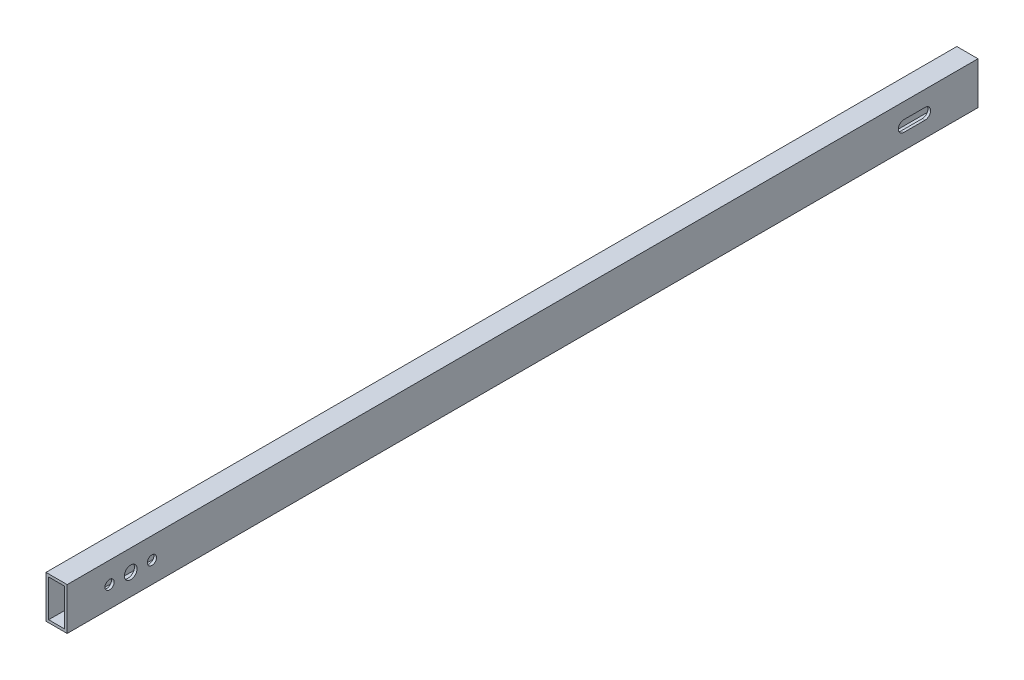
from build123d import *

# Parameters (mm, degrees)
SKETCH1_W           = 12.7
SKETCH1_H           = 25.4
SKETCH1_W_2         = 9.525
SKETCH1_H_2         = 22.225
BOSS_EXTRUDE1_DEPTH = 546.1
SKETCH2_R           = 3.81
SKETCH2_R_2         = 2.75
CUT_EXTRUDE1_DEPTH  = 547.395269013
CUT_EXTRUDE3_REACH  = 548.395
CUT_EXTRUDE5_REACH  = 548.727
SKETCH5_R           = 2.75


with BuildPart() as part:
    # Sketch1 → Boss-Extrude1 (new body)
    with BuildSketch(Plane.XY):
        Rectangle(SKETCH1_W, SKETCH1_H)
        Rectangle(SKETCH1_W_2, SKETCH1_H_2, mode=Mode.SUBTRACT)
    extrude(amount=BOSS_EXTRUDE1_DEPTH)

    # Sketch2 → Cut-Extrude1 (cut, through all)
    with BuildSketch(Plane(origin=(6.35, 0, 0), x_dir=(0, 0, -1), z_dir=(1, 0, 0))):
        with Locations((-508, 0)):
            Circle(SKETCH2_R)
        with Locations((-520.7, 0)):
            Circle(SKETCH2_R_2)
        with Locations((-495.3, 0)):
            Circle(SKETCH2_R_2)
        with BuildLine():
            Line((-31.75, -3.302), (-44.45, -3.302))
            ThreePointArc((-44.45, -3.302), (-47.752, 0), (-44.45, 3.302))
            Line((-44.45, 3.302), (-31.75, 3.302))
            ThreePointArc((-31.75, 3.302), (-28.448, 0), (-31.75, -3.302))
        make_face()
    extrude(amount=-CUT_EXTRUDE1_DEPTH, mode=Mode.SUBTRACT)

    # Sketch4 → Cut-Extrude3 (cut, up to next)
    with BuildSketch(Plane.ZY.offset(6.35), mode=Mode.PRIVATE) as cut_extrude3_sk1:
        with BuildLine():
            Line((35.56, 5), (66.04, 5))
            ThreePointArc((66.04, 5), (71.04, 0), (66.04, -5))
            Line((66.04, -5), (35.56, -5))
            ThreePointArc((35.56, -5), (30.56, 0), (35.56, 5))
        make_face()
    cut_extrude3_tool1 = extrude(cut_extrude3_sk1.sketch, amount=-CUT_EXTRUDE3_REACH, mode=Mode.PRIVATE) & part.part
    # Sketch4 → Cut-Extrude3 (cut, up to next)
    with BuildSketch(Plane.ZY.offset(6.35), mode=Mode.PRIVATE) as cut_extrude3_sk2:
        with BuildLine():
            Line((495.3, 5), (520.7, 5))
            ThreePointArc((520.7, 5), (525.7, 0), (520.7, -5))
            Line((520.7, -5), (495.3, -5))
            ThreePointArc((495.3, -5), (490.3, 0), (495.3, 5))
        make_face()
    cut_extrude3_tool2 = extrude(cut_extrude3_sk2.sketch, amount=-CUT_EXTRUDE3_REACH, mode=Mode.PRIVATE) & part.part
    add(cut_extrude3_tool1.solids().sort_by_distance((-6.35, 0, 50.8))[0], mode=Mode.SUBTRACT)
    add(cut_extrude3_tool2.solids().sort_by_distance((-6.35, 0, 508))[0], mode=Mode.SUBTRACT)

    # Sketch5 → Cut-Extrude5 (cut, up to next)
    with BuildSketch(Plane.XZ.offset(12.7), mode=Mode.PRIVATE) as cut_extrude5_sk1:
        with Locations(Location((0, 533.4, 0), (0, 0, 270))):
            Circle(SKETCH5_R)
    cut_extrude5_tool1 = extrude(cut_extrude5_sk1.sketch, amount=-CUT_EXTRUDE5_REACH, mode=Mode.PRIVATE) & part.part
    # Sketch5 → Cut-Extrude5 (cut, up to next)
    with BuildSketch(Plane.XZ.offset(12.7), mode=Mode.PRIVATE) as cut_extrude5_sk2:
        with Locations(Location((0, 12.7, 0), (0, 0, 270))):
            Circle(SKETCH5_R)
    cut_extrude5_tool2 = extrude(cut_extrude5_sk2.sketch, amount=-CUT_EXTRUDE5_REACH, mode=Mode.PRIVATE) & part.part
    add(cut_extrude5_tool1.solids().sort_by_distance((0, -12.7, 533.4))[0], mode=Mode.SUBTRACT)
    add(cut_extrude5_tool2.solids().sort_by_distance((0, -12.7, 12.7))[0], mode=Mode.SUBTRACT)


solid = part.part
